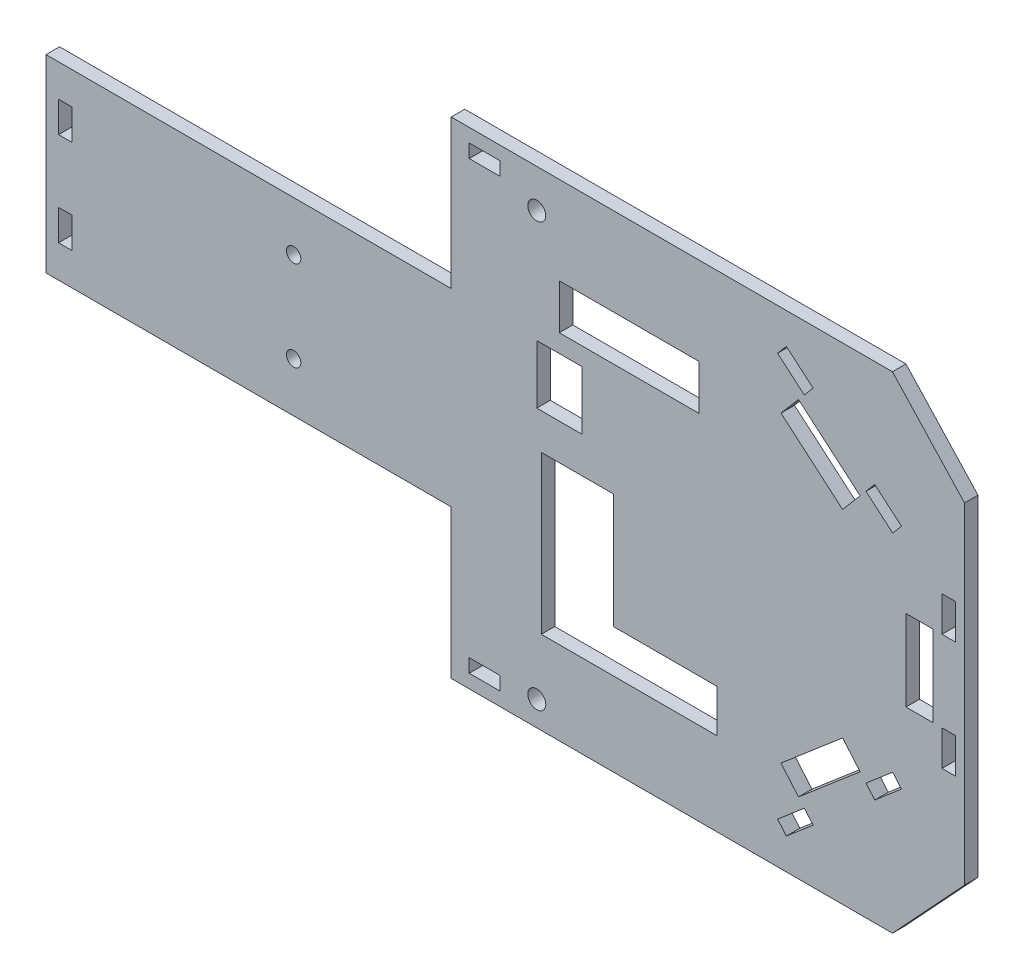
from build123d import *

# Parameters (mm, degrees)
RESSALTO_EXTRUS_O1_DEPTH = 3
ESBO_O2_W                = 31
ESBO_O2_H                = 10
ESBO_O2_W_2              = 16
ESBO_O2_H_2              = 35
ESBO_O2_W_3              = 10
ESBO_O2_H_3              = 13
ESBO_O2_W_4              = 23
ESBO_O2_H_4              = 9.5
ESBO_O2_R                = 2
CORTE_EXTRUS_O1_DEPTH    = 231.844103239
ESBO_O3_W                = 3
ESBO_O3_H                = 7.8
ESBO_O3_W_2              = 6
ESBO_O3_H_2              = 18
ESBO_O3_H_3              = 6.8
CORTE_EXTRUS_O2_DEPTH    = 10
ESBO_O4_W                = 6.8
ESBO_O4_H                = 3
CORTE_EXTRUS_O3_DEPTH    = 10
ESBO_O6_R                = 1.6
CORTE_EXTRUS_O5_DEPTH    = 10


with BuildPart() as part:
    # Esboço1 → Ressalto-extrusão1 (new body)
    with BuildSketch(Plane.XY):
        Polygon((0, 33), (0, 75), (90, 75), (90, 108), (188, 108), (204, 90.756494192), (204, 17.243505808), (188, 0), (90, 0), (90, 33), align=None)
    extrude(amount=RESSALTO_EXTRUS_O1_DEPTH)

    # Esboço2 → Corte-extrusão1 (cut, through all)
    with BuildSketch(Plane.XY.offset(3)):
        with Locations((129.5, 83.5)):
            Rectangle(ESBO_O2_W, ESBO_O2_H)
        with Locations((118, 36)):
            Rectangle(ESBO_O2_W_2, ESBO_O2_H_2)
        with Locations((114, 68)):
            Rectangle(ESBO_O2_W_3, ESBO_O2_H_3)
        with Locations((137.5, 23.25)):
            Rectangle(ESBO_O2_W_4, ESBO_O2_H_4)
        with Locations((109, 5.5)):
            Circle(ESBO_O2_R)
        with Locations((109, 99.5)):
            Circle(ESBO_O2_R)
    extrude(amount=-CORTE_EXTRUS_O1_DEPTH, mode=Mode.SUBTRACT)

    # Esboço3 → Corte-extrusão2 (cut)
    with BuildSketch(Plane.XY.offset(3)):
        Polygon((164.43729409, 6.911468095), (170.371493676, 11.973609467), (168.424516225, 14.255993924), (162.490316639, 9.193852552), align=None)
        with Locations((200.5, 41.1)):
            Rectangle(ESBO_O3_W, ESBO_O3_H)
        Polygon((190, 28.717615544), (188.053022549, 31), (182.118822963, 25.937858628), (184.065800414, 23.655474172), align=None)
        Polygon((184.065800414, 84.344525828), (190, 79.282384456), (188.053022549, 77), (182.118822963, 82.062141372), align=None)
        Polygon((162.490316639, 98.806147448), (164.43729409, 101.088531905), (170.371493676, 96.026390533), (168.424516225, 93.744006076), align=None)
        Polygon((167.126531258, 15.777583561), (180.820837996, 27.459448266), (176.926883094, 32.024217178), (163.232576357, 20.342352474), align=None)
        with Locations((200.5, 66.9)):
            Rectangle(ESBO_O3_W, ESBO_O3_H)
        with Locations((194, 54)):
            Rectangle(ESBO_O3_W_2, ESBO_O3_H_2)
        Polygon((176.926883094, 75.975782822), (163.232576357, 87.657647526), (167.126531258, 92.222416439), (180.820837996, 80.540551734), align=None)
        with Locations((4.3, 43.6)):
            Rectangle(ESBO_O3_W, ESBO_O3_H_3)
        with Locations((4.3, 64.4)):
            Rectangle(ESBO_O3_W, ESBO_O3_H_3)
    extrude(amount=-CORTE_EXTRUS_O2_DEPTH, mode=Mode.SUBTRACT)

    # Esboço4 → Corte-extrusão3 (cut)
    with BuildSketch(Plane.XY.offset(3)):
        with Locations((97.4, 103.5)):
            Rectangle(ESBO_O4_W, ESBO_O4_H)
        with Locations((97.4, 4.5)):
            Rectangle(ESBO_O4_W, ESBO_O4_H)
    extrude(amount=-CORTE_EXTRUS_O3_DEPTH, mode=Mode.SUBTRACT)

    # Esboço6 → Corte-extrusão5 (cut)
    with BuildSketch(Plane.XY.offset(3)):
        with Locations((55, 44)):
            Circle(ESBO_O6_R)
        with Locations(Location((55, 64, 0), (0, 0, 180))):
            Circle(ESBO_O6_R)
    extrude(amount=-CORTE_EXTRUS_O5_DEPTH, mode=Mode.SUBTRACT)


solid = part.part
